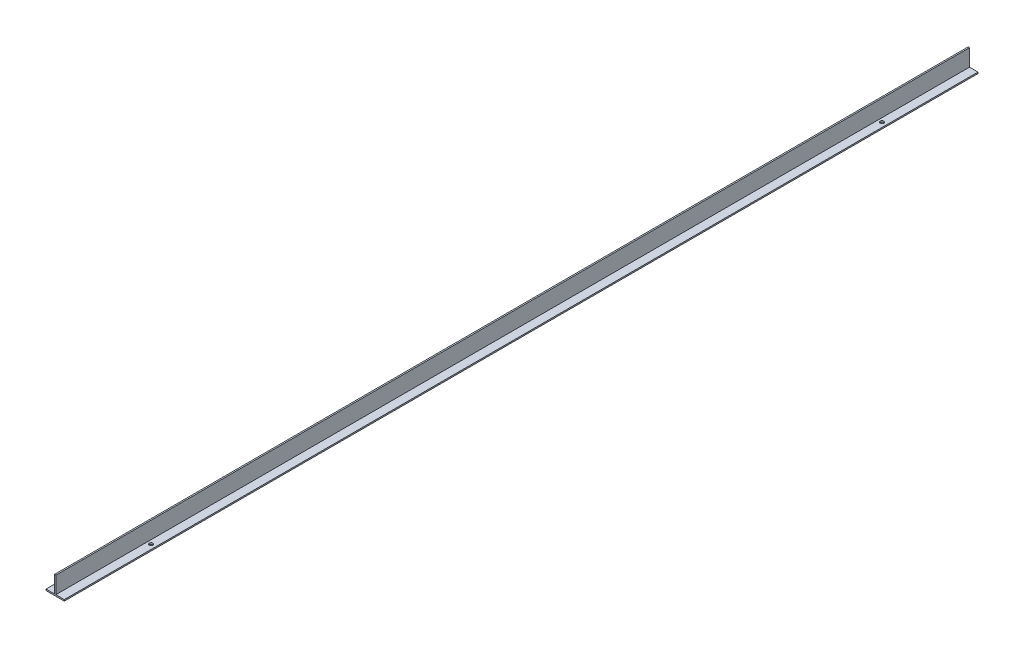
from build123d import *

# Parameters (mm, degrees)
EXTRUDE_1_DEPTH     = 1000
SKETCH_2_R          = 2
CUT_EXTRUDE_1_DEPTH = 10


with BuildPart() as part:
    # Эскиз1 → Бобышка-Вытянуть1 (new body)
    with BuildSketch(Plane.XY):
        Polygon((0.75, 20), (-0.75, 20), (-0.75, 1.5), (-10, 1.5), (-10, 0), (10, 0), (10, 1.5), (0.75, 1.5), align=None)
    extrude(amount=EXTRUDE_1_DEPTH)

    # Эскиз2 → Вырез-Вытянуть1 (cut)
    with BuildSketch(Plane.XZ):
        with Locations(Location((5, 900, 0), (0, 0, 270))):
            Circle(SKETCH_2_R)
        with Locations(Location((-5, 900, 0), (0, 0, 270))):
            Circle(SKETCH_2_R)
        with Locations((5, 100)):
            Circle(SKETCH_2_R)
        with Locations((-5, 100)):
            Circle(SKETCH_2_R)
    extrude(amount=-CUT_EXTRUDE_1_DEPTH, mode=Mode.SUBTRACT)


solid = part.part
